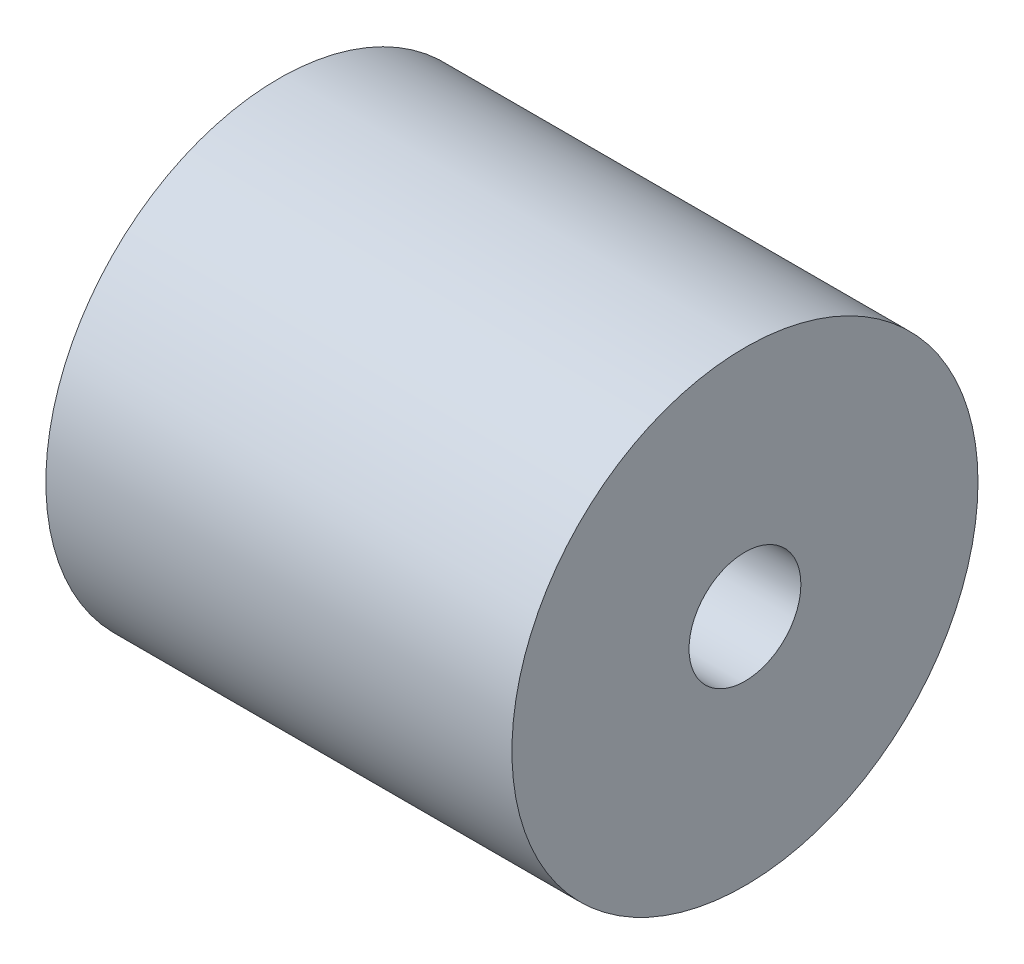
from build123d import *


with BuildPart() as part:
    # Sketch1 → Revolve1 (revolve)
    with BuildSketch(Plane.XY, mode=Mode.PRIVATE) as revolve1_sk:
        Polygon((-25, 2), (-25, 12.5), (0, 12.5), (0, 3), (-12.5, 3), (-12.5, 2), align=None)
    revolve(revolve1_sk.sketch.rotate(Axis((0, 0, 0), (-1, 0, 0)), 90), axis=Axis((0, 0, 0), (-1, 0, 0)))


solid = part.part
